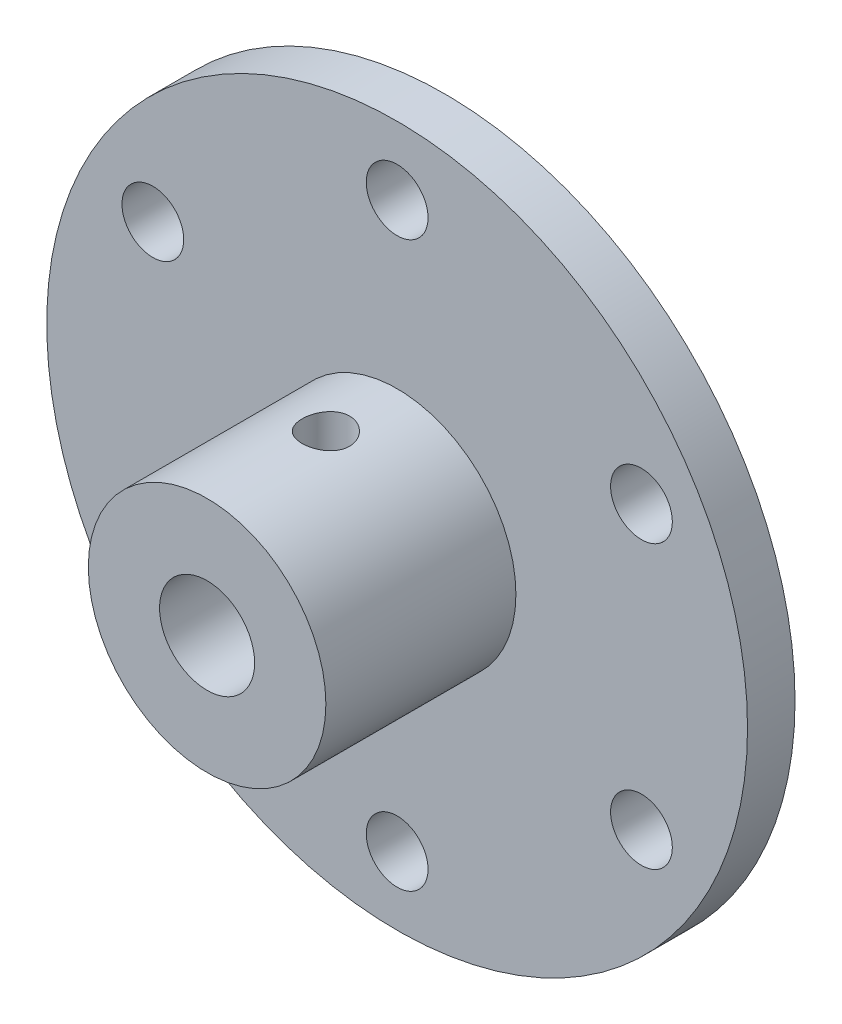
from build123d import *

# Parameters (mm, degrees)
SKETCH1_R               = 29.5
BOSS_EXTRUDE1_DEPTH     = 4
SKETCH2_R               = 10
BOSS_EXTRUDE2_DEPTH     = 16
SKETCH3_R               = 4
CUT_EXTRUDE1_DEPTH      = 20
SKETCH4_R               = 2.6
CUT_EXTRUDE2_DEPTH      = 4
CUT_EXTRUDE3_DEPTH      = 47.265537931
CUT_EXTRUDE3_DEPTH_BACK = 47.265537931
SKETCH5_R               = 2


with BuildPart() as part:
    # Sketch1 → Boss-Extrude1 (new body)
    with BuildSketch(Plane.XY):
        Circle(SKETCH1_R)
    extrude(amount=BOSS_EXTRUDE1_DEPTH)

    # Sketch2 → Boss-Extrude2 (add)
    with BuildSketch(Plane.XY.offset(4)):
        Circle(SKETCH2_R)
    extrude(amount=BOSS_EXTRUDE2_DEPTH)

    # Sketch3 → Cut-Extrude1 (cut)
    with BuildSketch(Plane.XY.offset(20)):
        Circle(SKETCH3_R)
    extrude(amount=-CUT_EXTRUDE1_DEPTH, mode=Mode.SUBTRACT)

    # Sketch4 → Cut-Extrude2 (cut)
    with BuildSketch(Plane.XY.offset(4)):
        with Locations((0, 23.75)):
            Circle(SKETCH4_R)
        with Locations((20.56810334, 11.875)):
            Circle(SKETCH4_R)
        with Locations((20.56810334, -11.875)):
            Circle(SKETCH4_R)
        with Locations((0, -23.75)):
            Circle(SKETCH4_R)
        with Locations((-20.56810334, -11.875)):
            Circle(SKETCH4_R)
        with Locations((-20.56810334, 11.875)):
            Circle(SKETCH4_R)
    extrude(amount=-CUT_EXTRUDE2_DEPTH, mode=Mode.SUBTRACT)

    # Sketch5 → Cut-Extrude3 (cut, two sides: drawn at the far end of the back side and taken through both)
    with BuildSketch(Plane(origin=(0, 0, 0), x_dir=(1, 0, 0), z_dir=(0, 1, 0)).offset(-CUT_EXTRUDE3_DEPTH_BACK)):
        with Locations(Location((0, -10, 0), (0, 0, 270))):
            Circle(SKETCH5_R)
    extrude(amount=CUT_EXTRUDE3_DEPTH + CUT_EXTRUDE3_DEPTH_BACK, mode=Mode.SUBTRACT)


solid = part.part
